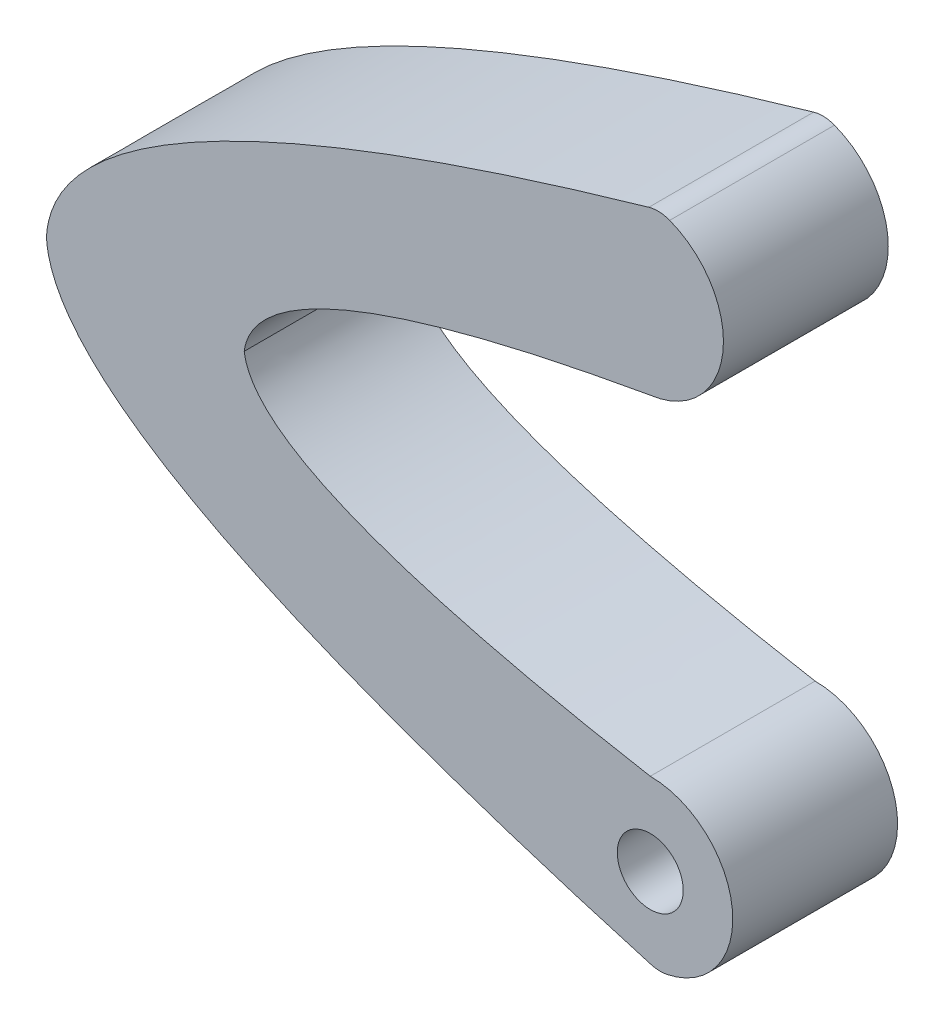
from build123d import *

# Parameters (mm, degrees)
SKETCH1_R           = 2
BOSS_EXTRUDE2_DEPTH = 10
FILLET4_R           = 2
FILLET5_R           = 2


with BuildPart() as part:
    # Sketch1 → Boss-Extrude2 (new body)
    with BuildSketch(Plane.XY):
        with BuildLine():
            ThreePointArc((47.515201165, 28.636720293), (51.481242597, 23.445158013), (47.04657628, 18.647706792))
            add(Edge.make_bspline(
                [(47.04657628, 18.647706792), (23.149465596, 14.415740026), (22.411661364, 8.636217355)],
                knots=[0, 0, 0, 0.485397068, 0.485397068, 0.485397068], degree=2))
            add(Edge.make_bspline(
                [(47.04657628, -1.374266206), (23.149465596, 2.856694684), (22.411661364, 8.636217355)],
                knots=[0, 0, 0, 0.485397068, 0.485397068, 0.485397068], degree=2))
            ThreePointArc((47.04657628, -1.374266206), (52.04657628, -6.145195345), (47.515201165, -11.363279707))
            add(Edge.make_bspline(
                [(47.515201165, -11.363279707), (10.933254614, -0.926951504), (10.411661364, 8.636217355)],
                knots=[0, 0, 0, 0.478869132, 0.478869132, 0.478869132], degree=2))
            add(Edge.make_bspline(
                [(47.515201165, 28.636720293), (10.933254614, 18.199386214), (10.411661364, 8.636217355)],
                knots=[0, 0, 0, 0.478869132, 0.478869132, 0.478869132], degree=2))
        make_face()
        with Locations((47.04657628, -6.379765498)):
            Circle(SKETCH1_R, mode=Mode.SUBTRACT)
    extrude(amount=BOSS_EXTRUDE2_DEPTH)

    # Fillet4
    fillet4_edges = [part.edges().sort_by_distance(p)[0] for p in [
        (47.515201165, 28.636720293, 5),
    ]]
    fillet(fillet4_edges, radius=FILLET4_R)

    # Fillet5
    fillet5_edges = [part.edges().sort_by_distance(p)[0] for p in [
        (47.515201165, -11.363279707, 5),
    ]]
    fillet(fillet5_edges, radius=FILLET5_R)


solid = part.part
